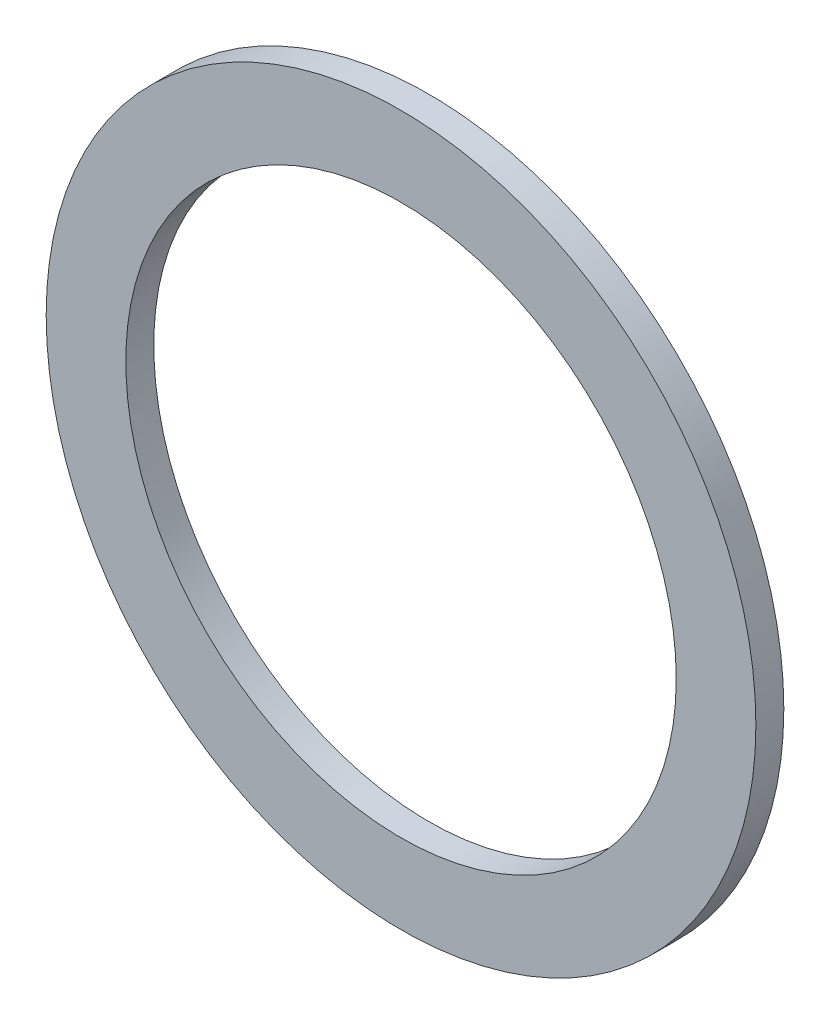
from build123d import *

# Parameters (mm, degrees)
SKETCH1_R           = 63.5
SKETCH1_R_2         = 49.25
BOSS_EXTRUDE1_DEPTH = 5


with BuildPart() as part:
    # Sketch1 → Boss-Extrude1 (new body)
    with BuildSketch(Plane.XY):
        Circle(SKETCH1_R)
        Circle(SKETCH1_R_2, mode=Mode.SUBTRACT)
    extrude(amount=BOSS_EXTRUDE1_DEPTH)


solid = part.part
